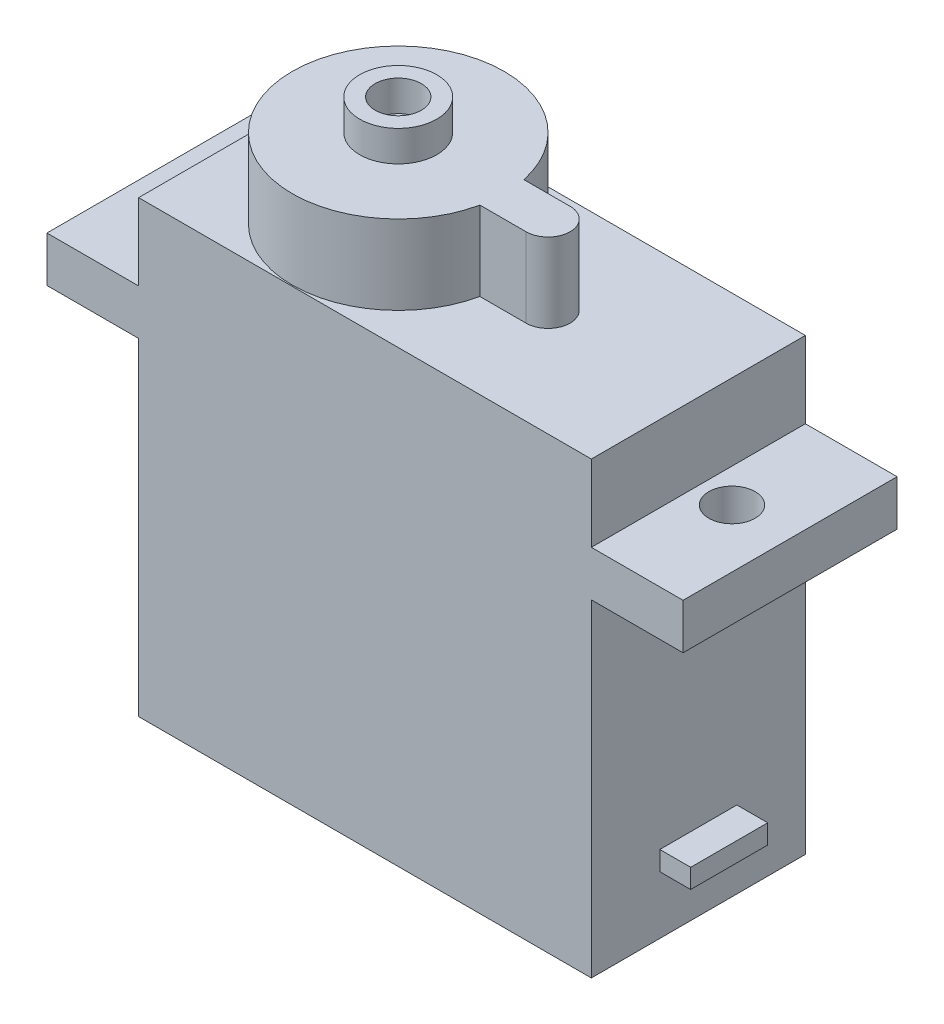
from build123d import *

# Parameters (mm, degrees)
BOSS_EXTRUDE1_DEPTH = 27.775
SKETCH2_R           = 27.5
BOSS_EXTRUDE2_DEPTH = 20.55
SKETCH3_R           = 10
SKETCH3_R_2         = 6
EXTRUDE_THIN1_DEPTH = 8
SKETCH4_R           = 6
CUT_EXTRUDE2_DEPTH  = 11.8
SKETCH5_W           = 20
SKETCH5_H           = 5
BOSS_EXTRUDE3_DEPTH = 8


with BuildPart() as part:
    # Sketch1 → Boss-Extrude1 (new, symmetric)
    with BuildSketch(Plane.XY):
        Polygon((-58.75, 0), (58.75, 0), (58.75, 85), (82.55, 85), (82.55, 96.8), (58.75, 96.8), (58.75, 116.65), (-58.75, 116.65), (-58.75, 96.8), (-82.55, 96.8), (-82.55, 85), (-58.75, 85), align=None)
    extrude(amount=BOSS_EXTRUDE1_DEPTH, both=True)

    # Sketch2 → Boss-Extrude2 (add)
    with BuildSketch(Plane(origin=(0, 116.65, 0), x_dir=(1, 0, 0), z_dir=(0, 1, 0))):
        with BuildLine():
            Line((19.756400184, 5.711832399), (7.756400184, 5.711832399))
            ThreePointArc((7.756400184, 5.711832399), (8.205780532, 2.871615204), (8.356121921, 0))
            ThreePointArc((8.356121921, 0), (8.205780532, -2.871615204), (7.756400184, -5.711832399))
            Line((7.756400184, -5.711832399), (19.756400184, -5.711832399))
            ThreePointArc((19.756400184, -5.711832399), (25.468232583, 0), (19.756400184, 5.711832399))
        make_face()
        with Locations((-19.143878079, 0)):
            Circle(SKETCH2_R)
    extrude(amount=BOSS_EXTRUDE2_DEPTH)

    # Sketch3 → Extrude-Thin1 (add)
    with BuildSketch(Plane(origin=(0, 137.2, 0), x_dir=(1, 0, 0), z_dir=(0, 1, 0))):
        with Locations((-19.143878079, 0)):
            Circle(SKETCH3_R)
        with Locations((-19.143878079, 0)):
            Circle(SKETCH3_R_2, mode=Mode.SUBTRACT)
    extrude(amount=EXTRUDE_THIN1_DEPTH)

    # Sketch4 → Cut-Extrude2 (cut)
    with BuildSketch(Plane(origin=(0, 96.8, 0), x_dir=(1, 0, 0), z_dir=(0, 1, 0))):
        with Locations(Location((67.475, 0, 0), (0, 0, 180))):
            Circle(SKETCH4_R)
        with Locations(Location((-67.475, 0, 0), (0, 0, 180))):
            Circle(SKETCH4_R)
    extrude(amount=-CUT_EXTRUDE2_DEPTH, mode=Mode.SUBTRACT)

    # Sketch5 → Boss-Extrude3 (add)
    with BuildSketch(Plane(origin=(58.75, 0, 0), x_dir=(0, 0, -1), z_dir=(1, 0, 0))):
        with Locations((0, 17.5)):
            Rectangle(SKETCH5_W, SKETCH5_H)
    boss_extrude3 = extrude(amount=BOSS_EXTRUDE3_DEPTH)

    # Mirror1: Boss-Extrude3 across plane
    add(boss_extrude3.mirror(Plane(origin=(0, 0, 0), x_dir=(0, 0, 1), z_dir=(1, 0, 0))))


solid = part.part
